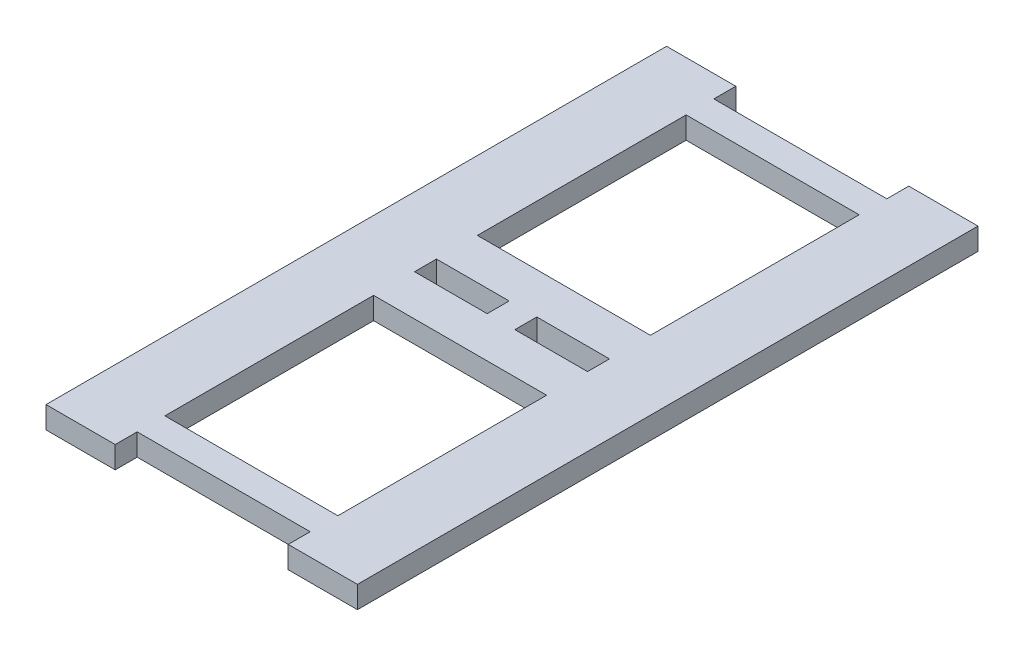
from build123d import *

# Parameters (mm, degrees)
SKETCH1_W             = 10
SKETCH1_H             = 3.175
BOSS_EXTRUDE1_DEPTH   = 89.675
BOSS_EXTRUDE1_2_DEPTH = 89.675
SKETCH2_W             = 25
SKETCH2_H             = 4
SKETCH2_H_2           = 15
BOSS_EXTRUDE2_DEPTH   = 3.175
SKETCH3_W             = 10.5
SKETCH3_H             = 3.175
CUT_EXTRUDE3_DEPTH    = 3.175


with BuildPart() as part:
    # Sketch1 → Boss-Extrude1 (new body)
    with BuildSketch(Plane.XY):
        with Locations((-22.5, 20.7875)):
            Rectangle(SKETCH1_W, SKETCH1_H)
    extrude(amount=-BOSS_EXTRUDE1_DEPTH)



with BuildPart() as body_2:
    # Sketch1 → Boss-Extrude1 2 (new body)
    with BuildSketch(Plane.XY):
        with Locations((-57.5, 20.7875)):
            Rectangle(SKETCH1_W, SKETCH1_H)
    extrude(amount=-BOSS_EXTRUDE1_2_DEPTH)


with BuildPart() as part_1:
    add(part.part)

    add(body_2.part)  # Boss-Extrude2 merges body 2
    # Sketch2 → Boss-Extrude2 (add)
    with BuildSketch(Plane(origin=(0, 22.375, 0), x_dir=(1, 0, 0), z_dir=(0, 1, 0))):
        with Locations((-40, 84.5)):
            Rectangle(SKETCH2_W, SKETCH2_H)
        with Locations((-40, 5.175)):
            Rectangle(SKETCH2_W, SKETCH2_H)
        with Locations((-40, 44.8375)):
            Rectangle(SKETCH2_W, SKETCH2_H_2)
    extrude(amount=-BOSS_EXTRUDE2_DEPTH)

    # Sketch3 → Cut-Extrude3 (cut)
    with BuildSketch(Plane(origin=(0, 22.375, 0), x_dir=(1, 0, 0), z_dir=(0, 1, 0))):
        with Locations((-32.75, 44.8375)):
            Rectangle(SKETCH3_W, SKETCH3_H)
        with Locations((-47.25, 44.8375)):
            Rectangle(SKETCH3_W, SKETCH3_H)
    extrude(amount=-CUT_EXTRUDE3_DEPTH, mode=Mode.SUBTRACT)


solid = part_1.part
